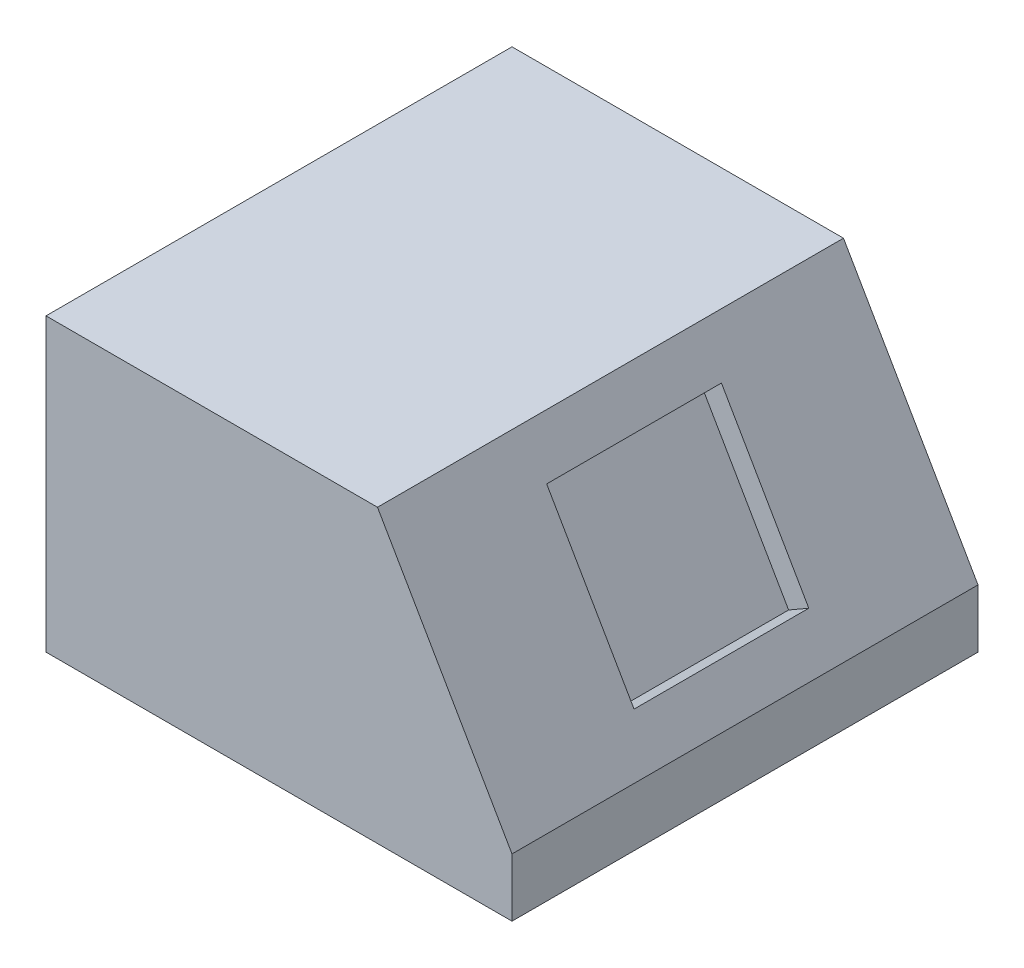
from build123d import *

# Parameters (mm, degrees)
ESQUISSE1_W             = 40
ESQUISSE1_H             = 40
BOSS_EXTRU_1_DEPTH      = 25
CHANFREIN1_SIZE         = 20
CHANFREIN1_SIZE2        = 11.547005384
ESQUISSE2_W             = 15
ESQUISSE2_H             = 15
ENL_V_MAT_EXTRU_1_DEPTH = 2


with BuildPart() as part:
    # Esquisse1 → Boss.-Extru.1 (new body)
    with BuildSketch(Plane(origin=(0, 0, 0), x_dir=(1, 0, 0), z_dir=(0, 1, 0))):
        Rectangle(ESQUISSE1_W, ESQUISSE1_H)
    extrude(amount=BOSS_EXTRU_1_DEPTH)

    # Chanfrein1
    chanfrein1_edges = [part.edges().sort_by_distance(p)[0] for p in [
        (20, 25, 0),
    ]]
    chanfrein1_side = [part.faces().sort_by_distance(p)[0] for p in [
        (20, 12.5, 0),
    ]]
    chamfer(chanfrein1_edges, length=CHANFREIN1_SIZE, length2=CHANFREIN1_SIZE2, reference=chanfrein1_side[0])

    # Esquisse2 → Enlèv. mat.-Extru.1 (cut)
    with BuildSketch(Plane(origin=(17.165063509, 9.910254038, 0), x_dir=(0, 0, -1), z_dir=(0.8660254037844397, 0.4999999999999983, 0))):
        with Locations((0, 5.877132403)):
            Rectangle(ESQUISSE2_W, ESQUISSE2_H)
    extrude(amount=-ENL_V_MAT_EXTRU_1_DEPTH, mode=Mode.SUBTRACT)


solid = part.part
